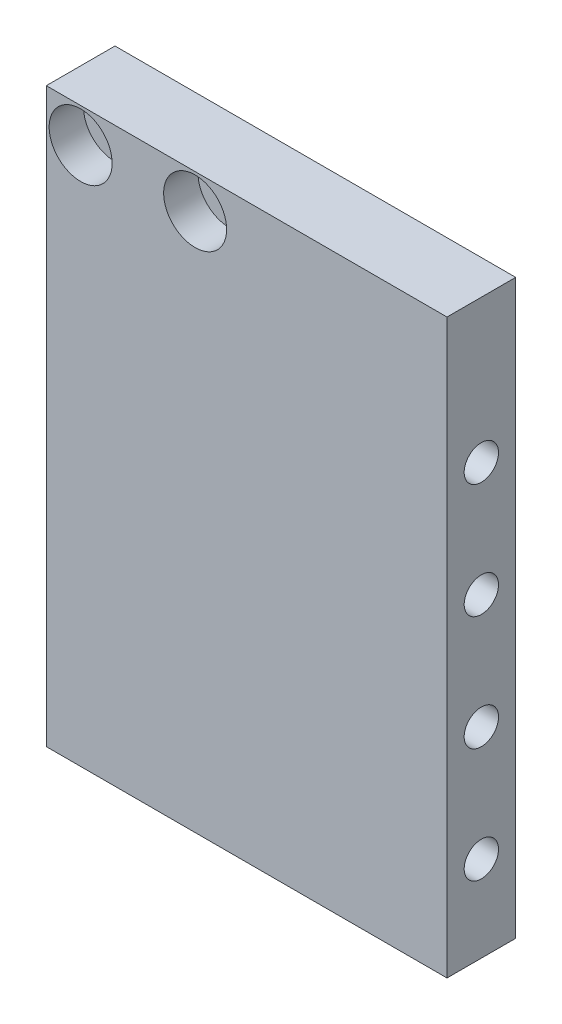
from build123d import *

# Parameters (mm, degrees)
SKETCH_1_W          = 70
SKETCH_1_H          = 100
EXTRUDE_1_DEPTH     = 12
SKETCH_2_R          = 3
CUT_EXTRUDE_1_DEPTH = 10
SKETCH_3_R          = 3
CUT_EXTRUDE_2_DEPTH = 12
SKETCH_4_R          = 5.5
CUT_EXTRUDE_3_DEPTH = 6
CUT_EXTRUDE_START   = -10
SKETCH_5_R          = 3
CUT_EXTRUDE_4_DEPTH = 10
SKETCH_6_R          = 3
CUT_EXTRUDE_5_DEPTH = 10


with BuildPart() as part:
    # 草图1 → 凸台-拉伸1 (new body)
    with BuildSketch(Plane.XY):
        Rectangle(SKETCH_1_W, SKETCH_1_H)
    extrude(amount=EXTRUDE_1_DEPTH)

    # 草图2 → 切除-拉伸1 (cut)
    with BuildSketch(Plane.ZY.offset(35)):
        with Locations((6, -35)):
            Circle(SKETCH_2_R)
        with Locations((6, -15)):
            Circle(SKETCH_2_R)
        with Locations((6, 5)):
            Circle(SKETCH_2_R)
        with Locations((6, 25)):
            Circle(SKETCH_2_R)
    extrude(amount=-CUT_EXTRUDE_1_DEPTH, mode=Mode.SUBTRACT)

    # 草图3 → 切除-拉伸2 (cut)
    with BuildSketch(Plane.XY.offset(12)):
        with Locations((-29, 44)):
            Circle(SKETCH_3_R)
        with Locations((-9, 44)):
            Circle(SKETCH_3_R)
    extrude(amount=-CUT_EXTRUDE_2_DEPTH, mode=Mode.SUBTRACT)

    # 草图4 → 切除-拉伸3 (cut)
    with BuildSketch(Plane.XY.offset(12)):
        with Locations((-29, 44)):
            Circle(SKETCH_4_R)
        with Locations((-9, 44)):
            Circle(SKETCH_4_R)
    extrude(amount=-CUT_EXTRUDE_3_DEPTH, mode=Mode.SUBTRACT)

    # 草图5 → 切除-拉伸4 (cut)
    with BuildSketch(Plane(origin=(35, 0, 0), x_dir=(0, 0, -1), z_dir=(1, 0, 0)).offset(CUT_EXTRUDE_START)):
        with Locations(Location((-6, -35, 0), (0, 0, 180))):
            Circle(SKETCH_5_R)
        with Locations(Location((-6, -15, 0), (0, 0, 180))):
            Circle(SKETCH_5_R)
        with Locations(Location((-6, 5, 0), (0, 0, 180))):
            Circle(SKETCH_5_R)
        with Locations(Location((-6, 25, 0), (0, 0, 180))):
            Circle(SKETCH_5_R)
    extrude(amount=CUT_EXTRUDE_4_DEPTH, mode=Mode.SUBTRACT)

    # 草图6 → 切除-拉伸5 (cut)
    with BuildSketch(Plane.XZ.offset(50)):
        with Locations((-21, 6)):
            Circle(SKETCH_6_R)
        with Locations((-7, 6)):
            Circle(SKETCH_6_R)
        with Locations((7, 6)):
            Circle(SKETCH_6_R)
        with Locations((21, 6)):
            Circle(SKETCH_6_R)
    extrude(amount=-CUT_EXTRUDE_5_DEPTH, mode=Mode.SUBTRACT)


solid = part.part
